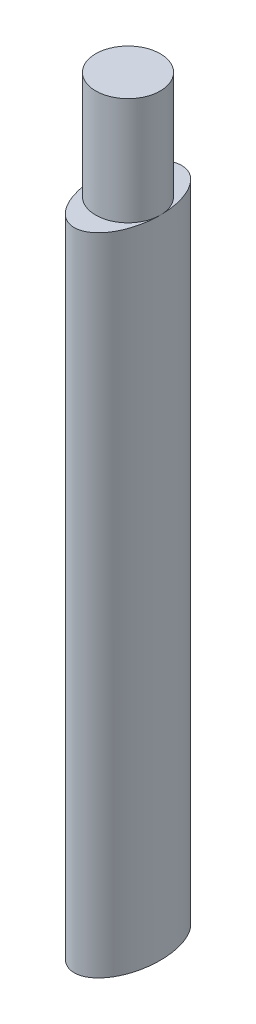
from build123d import *

# Parameters (mm, degrees)
SCHIZZO4_RX                  = 25
SCHIZZO4_RY                  = 15
ESTRUSIONE_ESTRUSIONE3_DEPTH = 300
SCHIZZO5_R                   = 15
ESTRUSIONE_ESTRUSIONE4_DEPTH = 50


with BuildPart() as part:
    # Schizzo4 → Estrusione-Estrusione3 (new body)
    with BuildSketch(Plane(origin=(0, 0, 0), x_dir=(1, 0, 0), z_dir=(0, 1, 0))):
        with Locations(Location((0, 0), (0, 0, 90))):
            Ellipse(SCHIZZO4_RX, SCHIZZO4_RY)
    extrude(amount=ESTRUSIONE_ESTRUSIONE3_DEPTH)

    # Schizzo5 → Estrusione-Estrusione4 (add)
    with BuildSketch(Plane(origin=(0, 300, 0), x_dir=(1, 0, 0), z_dir=(0, 1, 0))):
        with Locations(Location((0, 0, 0), (0, 0, 180))):
            Circle(SCHIZZO5_R)
    extrude(amount=ESTRUSIONE_ESTRUSIONE4_DEPTH)


solid = part.part
